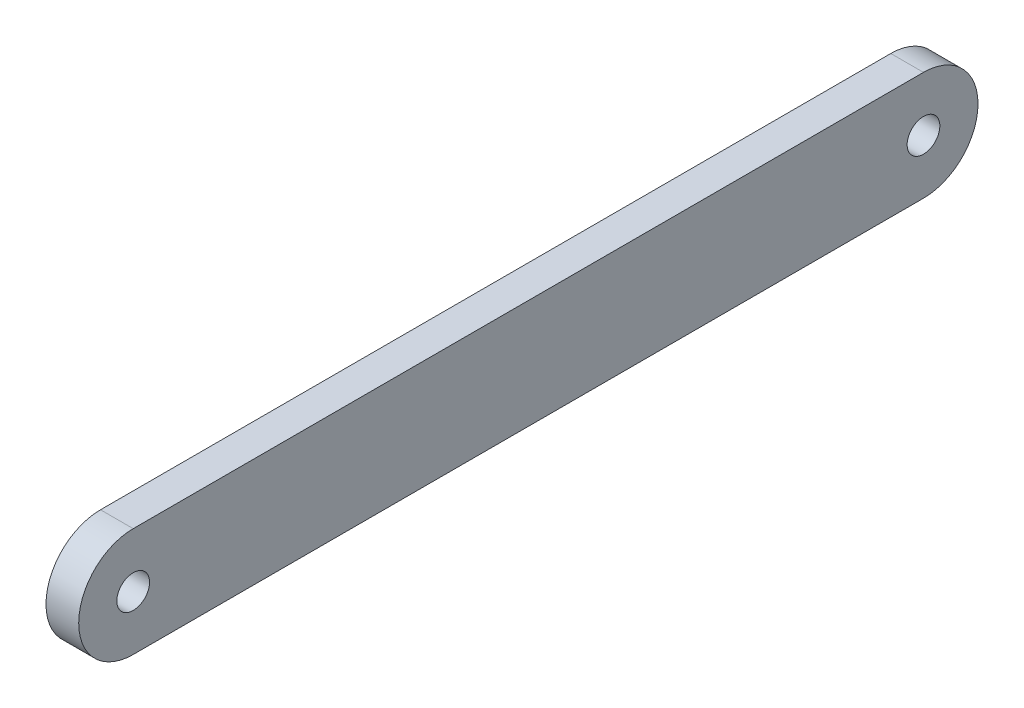
from build123d import *

# Parameters (mm, degrees)
BOSS_EXTRUDE1_DEPTH      = 36.25
BOSS_EXTRUDE1_DEPTH_BACK = 36.25
SKETCH2_W                = 3
SKETCH2_H                = 10
SKETCH3_W                = 3
SKETCH3_H                = 5
SKETCH4_R                = 1.5
CUT_EXTRUDE1_DEPTH       = 3


with BuildPart() as part:
    # Sketch2 → Boss-Extrude1 (new, two sides: drawn at the far end of the back side and taken through both)
    with BuildSketch(Plane.XY.offset(-BOSS_EXTRUDE1_DEPTH_BACK)):
        Rectangle(SKETCH2_W, SKETCH2_H)
    extrude(amount=BOSS_EXTRUDE1_DEPTH + BOSS_EXTRUDE1_DEPTH_BACK)

    # Sketch3 → Revolve1 (revolve)
    with BuildSketch(Plane(origin=(0, 0, -36.25), x_dir=(-1, 0, 0), z_dir=(0, 0, -1))):
        with Locations((0, -2.5)):
            Rectangle(SKETCH3_W, SKETCH3_H)
    revolve1 = revolve(axis=Axis((-1.5, 0, -36.25), (1, 0, 0)))

    # Sketch4 → Cut-Extrude1 (cut)
    with BuildSketch(Plane(origin=(1.5, 0, 0), x_dir=(0, 0, -1), z_dir=(1, 0, 0))):
        with Locations(Location((36.25, 0, 0), (0, 0, 90))):
            Circle(SKETCH4_R)
    cut_extrude1 = extrude(amount=-CUT_EXTRUDE1_DEPTH, mode=Mode.SUBTRACT)

    # Mirror1: Revolve1, Cut-Extrude1 across plane
    add(revolve1.mirror(Plane.XY))
    add(cut_extrude1.mirror(Plane.XY), mode=Mode.SUBTRACT)


solid = part.part
